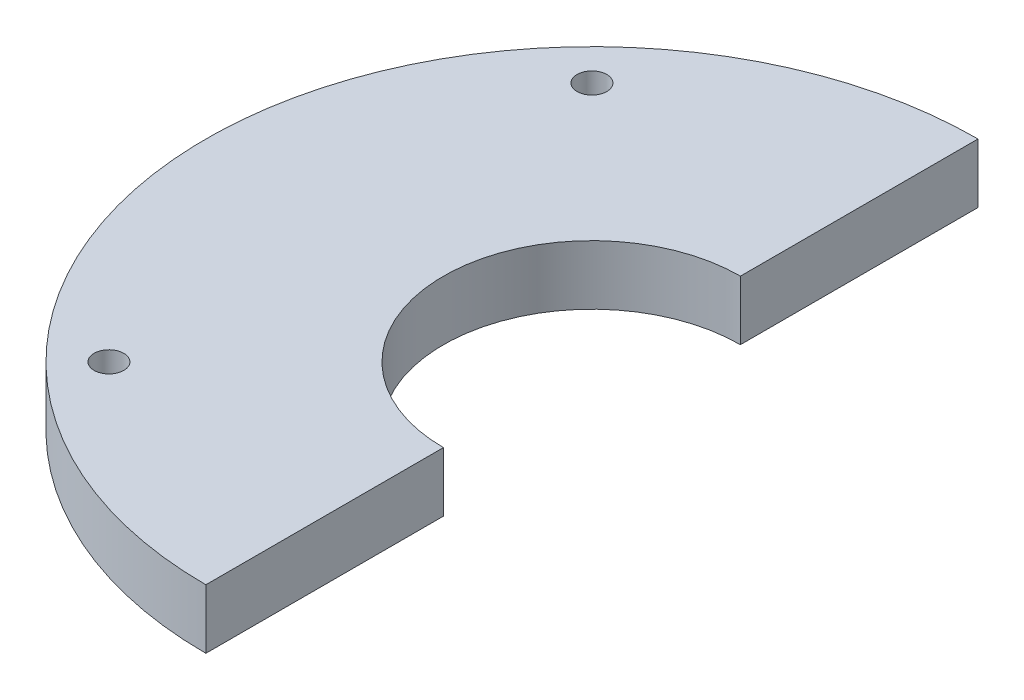
from build123d import *

# Parameters (mm, degrees)
BOSS_EXTRUDE1_DEPTH = 10
SKETCH2_R           = 2.5
CUT_EXTRUDE1_DEPTH  = 93.466210045


with BuildPart() as part:
    # Sketch1 → Boss-Extrude1 (new body)
    with BuildSketch(Plane(origin=(0, 0, 0), x_dir=(1, 0, 0), z_dir=(0, 1, 0))):
        with BuildLine():
            Line((0, 65), (0, 25))
            ThreePointArc((0, 25), (-25, 0), (0, -25))
            Line((0, -25), (0, -65))
            ThreePointArc((0, -65), (-65, 0), (0, 65))
        make_face()
    extrude(amount=BOSS_EXTRUDE1_DEPTH)

    # Sketch2 → Cut-Extrude1 (cut, through all)
    with BuildSketch(Plane(origin=(0, 10, 0), x_dir=(1, 0, 0), z_dir=(0, 1, 0))):
        with Locations(Location((-40.658639918, 40.658639918, 0), (0, 0, 270))):
            Circle(SKETCH2_R)
        with Locations(Location((-40.658639918, -40.658639918, 0), (0, 0, 90))):
            Circle(SKETCH2_R)
    extrude(amount=-CUT_EXTRUDE1_DEPTH, mode=Mode.SUBTRACT)


solid = part.part
